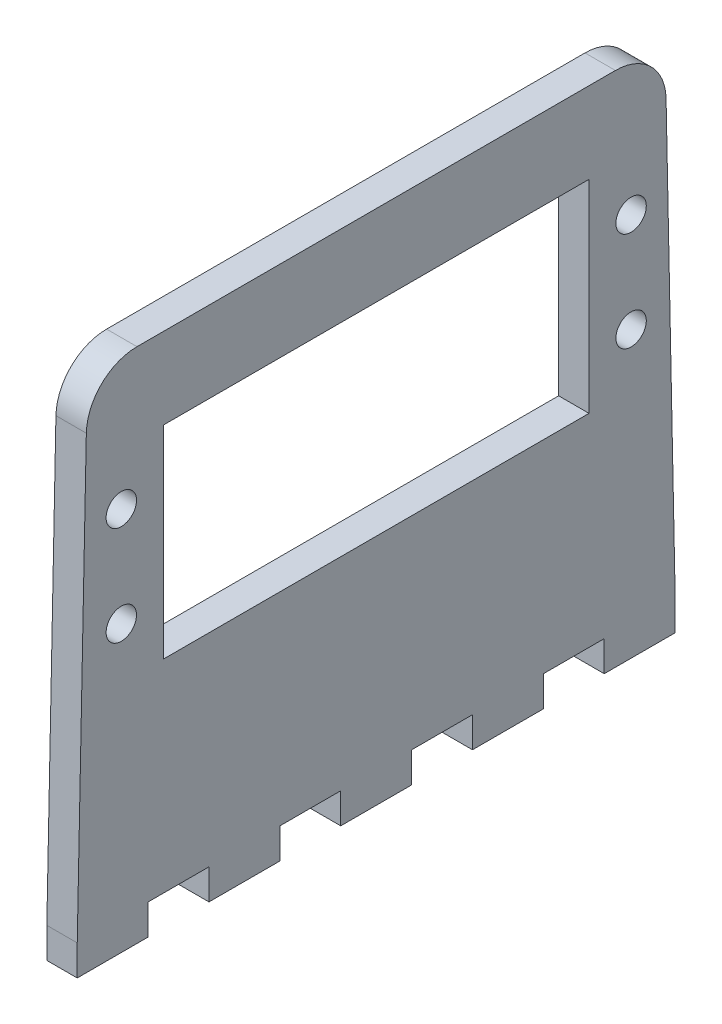
from build123d import *

# Parameters (mm, degrees)
SKETCH1_R           = 1.5
SKETCH1_W           = 42
SKETCH1_H           = 20
BOSS_EXTRUDE1_DEPTH = 3
FILLET1_R           = 5


with BuildPart() as part:
    # Sketch1 → Boss-Extrude1 (new body)
    with BuildSketch(Plane(origin=(0, 0, 0), x_dir=(0, 0, -1), z_dir=(1, 0, 0))):
        Polygon((-33, 0), (-32, 48), (25, 48), (26, 0), (26, -3), (19, -3), (19, 0), (13, 0), (13, -3), (6, -3), (6, 0), (0, 0), (0, -3), (-7, -3), (-7, 0), (-13, 0), (-13, -3), (-20, -3), (-20, 0), (-26, 0), (-26, -3), (-33, -3), align=None)
        with Locations((21.65, 34.9)):
            Circle(SKETCH1_R, mode=Mode.SUBTRACT)
        with Locations(Location((21.65, 25.1, 0), (0, 0, 180))):
            Circle(SKETCH1_R, mode=Mode.SUBTRACT)
        with Locations(Location((-28.65, 34.9, 0), (0, 0, 180))):
            Circle(SKETCH1_R, mode=Mode.SUBTRACT)
        with Locations((-28.65, 25.1)):
            Circle(SKETCH1_R, mode=Mode.SUBTRACT)
        with Locations((-3.5, 30)):
            Rectangle(SKETCH1_W, SKETCH1_H, mode=Mode.SUBTRACT)
    extrude(amount=BOSS_EXTRUDE1_DEPTH)

    # Fillet1
    fillet1_edges = [part.edges().sort_by_distance(p)[0] for p in [
        (1.5, 48, 32),
        (1.5, 48, -25),
    ]]
    fillet(fillet1_edges, radius=FILLET1_R)


solid = part.part
